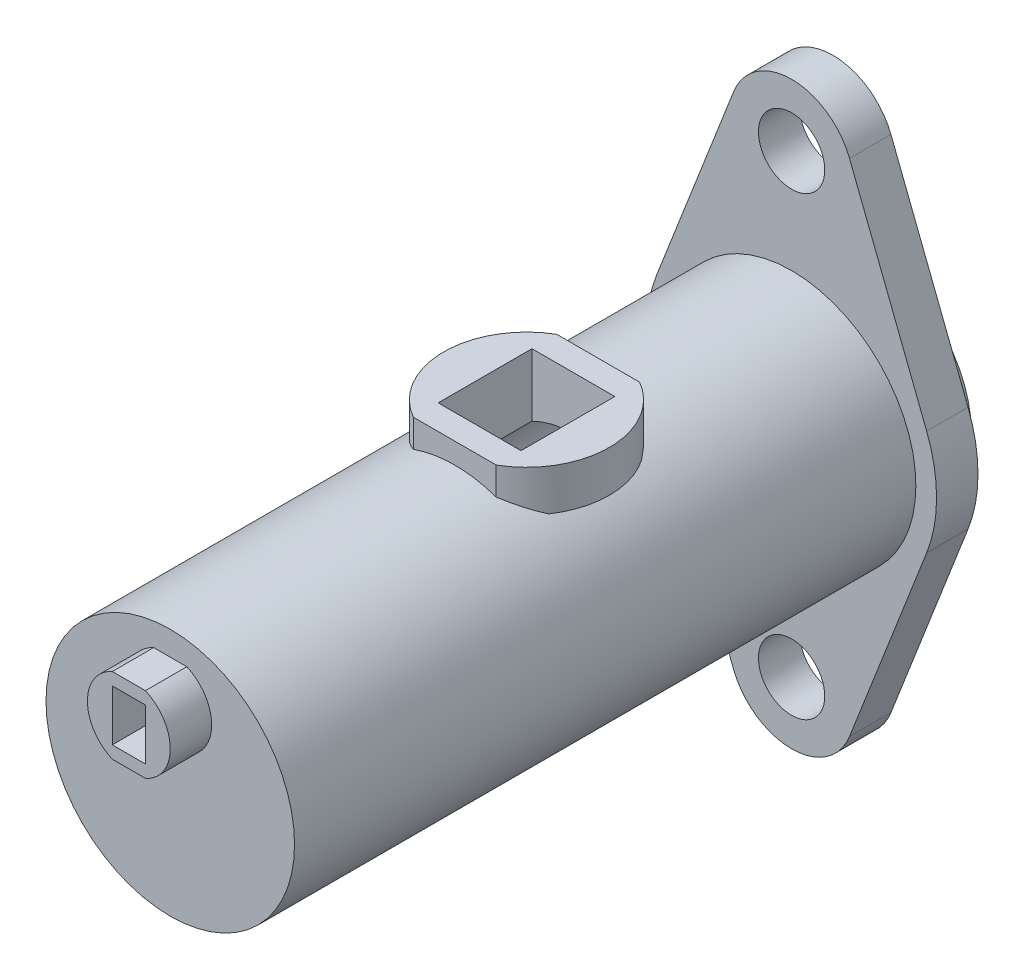
from build123d import *

# Parameters (mm, degrees)
SKETCH1_R           = 15
SKETCH1_R_2         = 4
BOSS_EXTRUDE1_DEPTH = 5
SKETCH3_R           = 15
SKETCH3_R_2         = 11.1125
BOSS_EXTRUDE2_DEPTH = 80
BOSS_EXTRUDE3_START = -2
SKETCH4_R           = 11.1125
BOSS_EXTRUDE3_DEPTH = 2
SKETCH5_W           = 4
SKETCH5_H           = 6.16515139
BOSS_EXTRUDE4_DEPTH = 5
SKETCH6_W           = 10
SKETCH6_H           = 11.320508076
BOSS_EXTRUDE5_DEPTH = 5
SKETCH8_R           = 4
CUT_EXTRUDE1_DEPTH  = 4
SKETCH10_W          = 4
SKETCH10_H          = 6.16515139
CUT_EXTRUDE2_DEPTH  = 2
SKETCH11_W          = 10
SKETCH11_H          = 11.320508076
CUT_EXTRUDE3_DEPTH  = 18.5


with BuildPart() as part:
    # Sketch1 → Boss-Extrude1 (new body)
    with BuildSketch(Plane.XY):
        with BuildLine():
            Line((-16.301967128, -6.363636364), (-6.98655734, -30.227272727))
            ThreePointArc((-6.98655734, -30.227272727), (0, -35), (6.98655734, -30.227272727))
            Line((6.98655734, -30.227272727), (16.301967128, -6.363636364))
            ThreePointArc((16.301967128, -6.363636364), (17.5, 0), (16.301967128, 6.363636364))
            Line((16.301967128, 6.363636364), (6.98655734, 30.227272727))
            ThreePointArc((6.98655734, 30.227272727), (0, 35), (-6.98655734, 30.227272727))
            Line((-6.98655734, 30.227272727), (-16.301967128, 6.363636364))
            ThreePointArc((-16.301967128, 6.363636364), (-17.5, 0), (-16.301967128, -6.363636364))
        make_face()
        Circle(SKETCH1_R, mode=Mode.SUBTRACT)
        with Locations((0, 27.5)):
            Circle(SKETCH1_R_2, mode=Mode.SUBTRACT)
        with Locations((0, -27.5)):
            Circle(SKETCH1_R_2, mode=Mode.SUBTRACT)
    extrude(amount=BOSS_EXTRUDE1_DEPTH)

    # Sketch3 → Boss-Extrude2 (add)
    with BuildSketch(Plane.XY):
        Circle(SKETCH3_R)
        Circle(SKETCH3_R_2, mode=Mode.SUBTRACT)
    extrude(amount=BOSS_EXTRUDE2_DEPTH)

    # Sketch4 → Boss-Extrude3 (add)
    with BuildSketch(Plane.XY.offset(80).offset(BOSS_EXTRUDE3_START)):
        Circle(SKETCH4_R)
    extrude(amount=BOSS_EXTRUDE3_DEPTH)

    # Sketch5 → Boss-Extrude4 (add)
    with BuildSketch(Plane.XY.offset(80)):
        with BuildLine():
            Line((-2, 12.082575695), (2, 12.082575695))
            ThreePointArc((2, 12.082575695), (5, 7.5), (2, 2.917424305))
            Line((2, 2.917424305), (-2, 2.917424305))
            ThreePointArc((-2, 2.917424305), (-5, 7.5), (-2, 12.082575695))
        make_face()
        with Locations((0, 7.5)):
            Rectangle(SKETCH5_W, SKETCH5_H, mode=Mode.SUBTRACT)
    extrude(amount=BOSS_EXTRUDE4_DEPTH)

    # Sketch6 → Boss-Extrude5 (add)
    with BuildSketch(Plane(origin=(0, 12.5, 0), x_dir=(1, 0, 0), z_dir=(0, 1, 0))):
        with BuildLine():
            Line((-5, -28.339745962), (5, -28.339745962))
            ThreePointArc((5, -28.339745962), (10, -37), (5, -45.660254038))
            Line((5, -45.660254038), (-5, -45.660254038))
            ThreePointArc((-5, -45.660254038), (-10, -37), (-5, -28.339745962))
        make_face()
        with Locations((0, -37)):
            Rectangle(SKETCH6_W, SKETCH6_H, mode=Mode.SUBTRACT)
    extrude(amount=BOSS_EXTRUDE5_DEPTH)

    # Sketch7 → Revolve1 (revolve)
    with BuildSketch(Plane(origin=(0, 0, 0), x_dir=(0, 0, -1), z_dir=(1, 0, 0))):
        Polygon((0, 15), (4, 12.690598923), (4, 0), (0, 0), align=None)
    revolve(axis=Axis((0, 0, -4), (0, 0, 1)))

    # Sketch8 → Cut-Extrude1 (cut)
    with BuildSketch(Plane(origin=(0, 0, -4), x_dir=(-1, 0, 0), z_dir=(0, 0, -1))):
        with Locations(Location((0, 0, 0), (0, 0, 90))):
            Circle(SKETCH8_R)
    extrude(amount=-CUT_EXTRUDE1_DEPTH, mode=Mode.SUBTRACT)

    # Sketch10 → Cut-Extrude2 (cut)
    with BuildSketch(Plane.XY.offset(80)):
        with Locations((0, 7.5)):
            Rectangle(SKETCH10_W, SKETCH10_H)
    extrude(amount=-CUT_EXTRUDE2_DEPTH, mode=Mode.SUBTRACT)

    # Sketch11 → Cut-Extrude3 (cut, symmetric)
    with BuildSketch(Plane(origin=(0, 12.5, 0), x_dir=(1, 0, 0), z_dir=(0, 1, 0))):
        with Locations((0, -37)):
            Rectangle(SKETCH11_W, SKETCH11_H)
    extrude(amount=CUT_EXTRUDE3_DEPTH, both=True, mode=Mode.SUBTRACT)


solid = part.part
